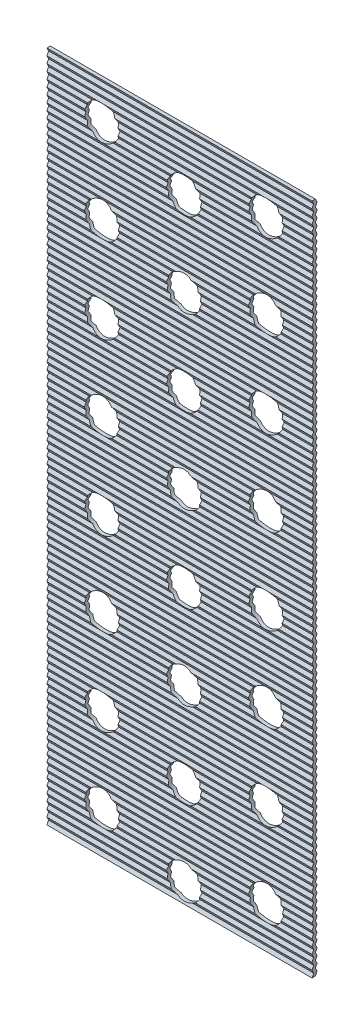
from build123d import *

# Parameters (mm, degrees)
EXTRUDE_1_DEPTH          = 78
CUT_EXTRUDE_1_DEPTH      = 10
CUT_EXTRUDE_1_DEPTH_BACK = 10
SKETCH_3_R               = 5


with BuildPart() as part:
    # Эскиз1 → Бобышка-Вытянуть1 (new body)
    with BuildSketch(Plane(origin=(0, 0, 0), x_dir=(0, 0, -1), z_dir=(1, 0, 0))):
        Polygon((1, 0), (0, 0), (0.5, 1), (0, 2), (0.5, 3), (0, 4), (0.5, 5), (0, 6), (0.5, 7), (0, 8), (0.5, 9), (0, 10), (0.5, 11), (0, 12), (0.5, 13), (0, 14), (0.5, 15), (0, 16), (0.5, 17), (0, 18), (0.5, 19), (0, 20), (0.5, 21), (0, 22), (0.5, 23), (0, 24), (0.5, 25), (0, 26), (0.5, 27), (0, 28), (0.5, 29), (0, 30), (0.5, 31), (0, 32), (0.5, 33), (0, 34), (0.5, 35), (0, 36), (0.5, 37), (0, 38), (0.5, 39), (0, 40), (0.5, 41), (0, 42), (0.5, 43), (0, 44), (0.5, 45), (0, 46), (0.5, 47), (0, 48), (0.5, 49), (0, 50), (0.5, 51), (0, 52), (0.5, 53), (0, 54), (0.5, 55), (0, 56), (0.5, 57), (0, 58), (0.5, 59), (0, 60), (0.5, 61), (0, 62), (0.5, 63), (0, 64), (0.5, 65), (0, 66), (0.5, 67), (0, 68), (0.5, 69), (0, 70), (0.5, 71), (0, 72), (0.5, 73), (0, 74), (0.5, 75), (0, 76), (0.5, 77), (0, 78), (0.5, 79), (0, 80), (0.5, 81), (0, 82), (0.5, 83), (0, 84), (0.5, 85), (0, 86), (0.5, 87), (0, 88), (0.5, 89), (0, 90), (0.5, 91), (0, 92), (0.5, 93), (0, 94), (0.5, 95), (0, 96), (0.5, 97), (0, 98), (0.5, 99), (0, 100), (0.5, 101), (0, 102), (0.5, 103), (0, 104), (0.5, 105), (0, 106), (0.5, 107), (0, 108), (0.5, 109), (0, 110), (0.5, 111), (0, 112), (0.5, 113), (0, 114), (0.5, 115), (0, 116), (0.5, 117), (0, 118), (0.5, 119), (0, 120), (0.5, 121), (0, 122), (0.5, 123), (0, 124), (0.5, 125), (0, 126), (0.5, 127), (0, 128), (0.5, 129), (0, 130), (0.5, 131), (0, 132), (0.5, 133), (0, 134), (0.5, 135), (0, 136), (0.5, 137), (0, 138), (0.5, 139), (0, 140), (0.5, 141), (0, 142), (0.5, 143), (0, 144), (0.5, 145), (0, 146), (0.5, 147), (0, 148), (0.5, 149), (0, 150), (0.5, 151), (0, 152), (0.5, 153), (0, 154), (0.5, 155), (0, 156), (0.5, 157), (0, 158), (0.5, 159), (0, 160), (0.5, 161), (0, 162), (0.5, 163), (0, 164), (0.5, 165), (0, 166), (0.5, 167), (0, 168), (0.5, 169), (0, 170), (0.5, 171), (0, 172), (0.5, 173), (0, 174), (0.5, 175), (0, 176), (0.5, 177), (0, 178), (0.5, 179), (0, 180), (0.5, 181), (0, 182), (0.5, 183), (0, 184), (0.5, 185), (0, 186), (0.5, 187), (0, 188), (0.5, 189), (0, 190), (0.5, 191), (0, 192), (0.5, 193), (0, 194), (0.5, 195), (0, 196), (0.5, 197), (0, 198), (1, 198), (1.5, 197), (1, 196), (1.5, 195), (1, 194), (1.5, 193), (1, 192), (1.5, 191), (1, 190), (1.5, 189), (1, 188), (1.5, 187), (1, 186), (1.5, 185), (1, 184), (1.5, 183), (1, 182), (1.5, 181), (1, 180), (1.5, 179), (1, 178), (1.5, 177), (1, 176), (1.5, 175), (1, 174), (1.5, 173), (1, 172), (1.5, 171), (1, 170), (1.5, 169), (1, 168), (1.5, 167), (1, 166), (1.5, 165), (1, 164), (1.5, 163), (1, 162), (1.5, 161), (1, 160), (1.5, 159), (1, 158), (1.5, 157), (1, 156), (1.5, 155), (1, 154), (1.5, 153), (1, 152), (1.5, 151), (1, 150), (1.5, 149), (1, 148), (1.5, 147), (1, 146), (1.5, 145), (1, 144), (1.5, 143), (1, 142), (1.5, 141), (1, 140), (1.5, 139), (1, 138), (1.5, 137), (1, 136), (1.5, 135), (1, 134), (1.5, 133), (1, 132), (1.5, 131), (1, 130), (1.5, 129), (1, 128), (1.5, 127), (1, 126), (1.5, 125), (1, 124), (1.5, 123), (1, 122), (1.5, 121), (1, 120), (1.5, 119), (1, 118), (1.5, 117), (1, 116), (1.5, 115), (1, 114), (1.5, 113), (1, 112), (1.5, 111), (1, 110), (1.5, 109), (1, 108), (1.5, 107), (1, 106), (1.5, 105), (1, 104), (1.5, 103), (1, 102), (1.5, 101), (1, 100), (1.5, 99), (1, 98), (1.5, 97), (1, 96), (1.5, 95), (1, 94), (1.5, 93), (1, 92), (1.5, 91), (1, 90), (1.5, 89), (1, 88), (1.5, 87), (1, 86), (1.5, 85), (1, 84), (1.5, 83), (1, 82), (1.5, 81), (1, 80), (1.5, 79), (1, 78), (1.5, 77), (1, 76), (1.5, 75), (1, 74), (1.5, 73), (1, 72), (1.5, 71), (1, 70), (1.5, 69), (1, 68), (1.5, 67), (1, 66), (1.5, 65), (1, 64), (1.5, 63), (1, 62), (1.5, 61), (1, 60), (1.5, 59), (1, 58), (1.5, 57), (1, 56), (1.5, 55), (1, 54), (1.5, 53), (1, 52), (1.5, 51), (1, 50), (1.5, 49), (1, 48), (1.5, 47), (1, 46), (1.5, 45), (1, 44), (1.5, 43), (1, 42), (1.5, 41), (1, 40), (1.5, 39), (1, 38), (1.5, 37), (1, 36), (1.5, 35), (1, 34), (1.5, 33), (1, 32), (1.5, 31), (1, 30), (1.5, 29), (1, 28), (1.5, 27), (1, 26), (1.5, 25), (1, 24), (1.5, 23), (1, 22), (1.5, 21), (1, 20), (1.5, 19), (1, 18), (1.5, 17), (1, 16), (1.5, 15), (1, 14), (1.5, 13), (1, 12), (1.5, 11), (1, 10), (1.5, 9), (1, 8), (1.5, 7), (1, 6), (1.5, 5), (1, 4), (1.5, 3), (1, 2), (1.5, 1), align=None)
    extrude(amount=EXTRUDE_1_DEPTH)

    # Эскиз3 → Вырез-Вытянуть1 (cut, two sides: drawn at the far end of the back side and taken through both)
    with BuildSketch(Plane.XY.offset(-CUT_EXTRUDE_1_DEPTH_BACK)):
        with Locations((16, 12)):
            Circle(SKETCH_3_R)
        with Locations((16, 37)):
            Circle(SKETCH_3_R)
        with Locations((40.148145657, 30.529523872)):
            Circle(SKETCH_3_R)
        with Locations((40.148145657, 55.529523872)):
            Circle(SKETCH_3_R)
        with Locations((64.296291314, 37)):
            Circle(SKETCH_3_R)
        with Locations((64.296291314, 62)):
            Circle(SKETCH_3_R)
        with Locations((16, 62)):
            Circle(SKETCH_3_R)
        with Locations((64.296291314, 12)):
            Circle(SKETCH_3_R)
        with Locations((40.148145657, 5.529523872)):
            Circle(SKETCH_3_R)
        with Locations((64.296291314, 87)):
            Circle(SKETCH_3_R)
        with Locations((40.148145657, 80.529523872)):
            Circle(SKETCH_3_R)
        with Locations((16, 87)):
            Circle(SKETCH_3_R)
        with Locations((16, 112)):
            Circle(SKETCH_3_R)
        with Locations((40.148145657, 105.529523872)):
            Circle(SKETCH_3_R)
        with Locations((64.296291314, 112)):
            Circle(SKETCH_3_R)
        with Locations((64.296291314, 137)):
            Circle(SKETCH_3_R)
        with Locations((40.148145657, 130.529523872)):
            Circle(SKETCH_3_R)
        with Locations((16, 137)):
            Circle(SKETCH_3_R)
        with Locations((16, 162)):
            Circle(SKETCH_3_R)
        with Locations((40.148145657, 155.529523872)):
            Circle(SKETCH_3_R)
        with Locations((64.296291314, 162)):
            Circle(SKETCH_3_R)
        with Locations((64.296291314, 187)):
            Circle(SKETCH_3_R)
        with Locations((40.148145657, 180.529523872)):
            Circle(SKETCH_3_R)
        with Locations((16, 187)):
            Circle(SKETCH_3_R)
    extrude(amount=CUT_EXTRUDE_1_DEPTH + CUT_EXTRUDE_1_DEPTH_BACK, mode=Mode.SUBTRACT)


solid = part.part
